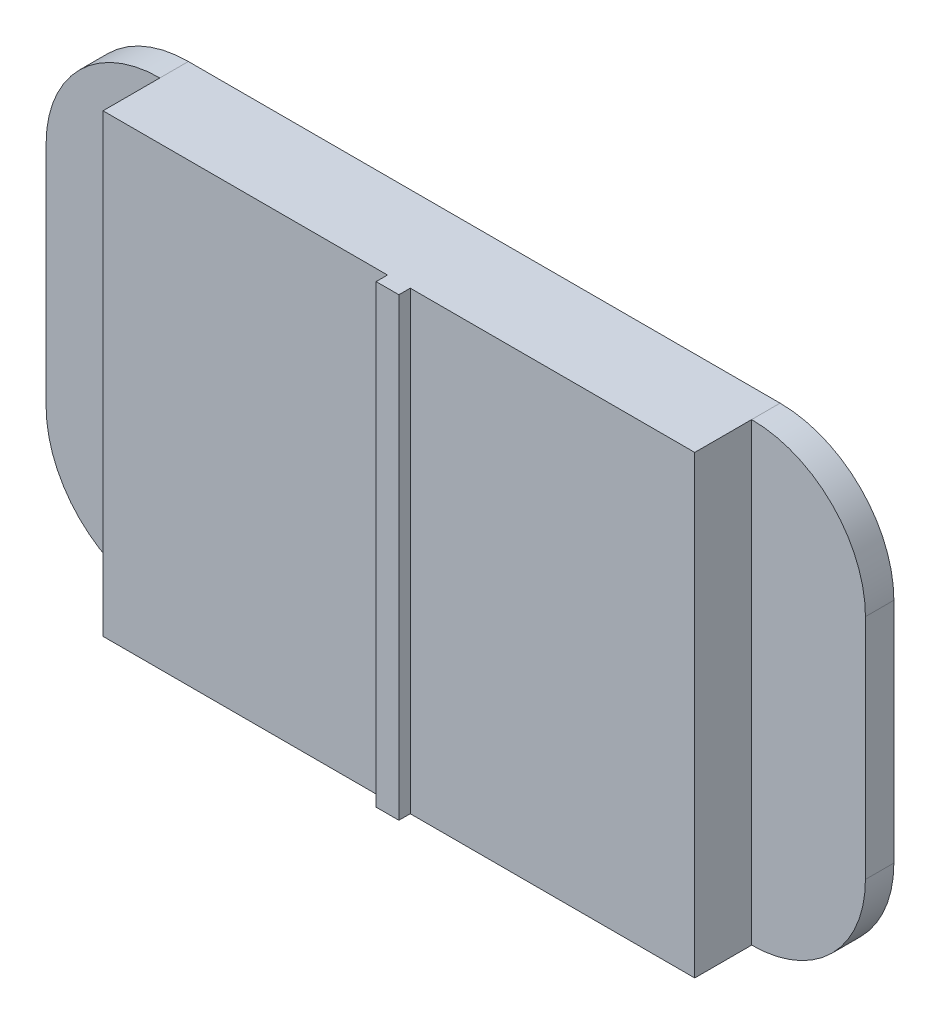
from build123d import *

# Parameters (mm, degrees)
EXTRUDE_1_DEPTH = 40
FILLET_3_R      = 10
FILLET_6_R      = 10
FILLET_7_R      = 10
FILLET_8_R      = 10


with BuildPart() as part:
    # Эскиз1 → Бобышка-Вытянуть1 (new body)
    with BuildSketch(Plane(origin=(0, 0, 0), x_dir=(1, 0, 0), z_dir=(0, 1, 0))):
        Polygon((-26, -14.521028037), (-26, -9.521028037), (-32, -9.521028037), (-36, -9.521028037), (-36, -7.021028037), (-1, -7.021028037), (1, -7.021028037), (36, -7.021028037), (36, -9.521028037), (32, -9.521028037), (26, -9.521028037), (26, -14.521028037), (1, -14.521028037), (1, -15.521028037), (-1, -15.521028037), (-1, -14.521028037), align=None)
    extrude(amount=EXTRUDE_1_DEPTH)

    # Скругление3
    fillet_3_edges = [part.edges().sort_by_distance(p)[0] for p in [
        (-36, 40, 8.271028037),
    ]]
    fillet(fillet_3_edges, radius=FILLET_3_R)

    # Скругление6
    fillet_6_edges = [part.edges().sort_by_distance(p)[0] for p in [
        (-36, 0, 8.271028037),
    ]]
    fillet(fillet_6_edges, radius=FILLET_6_R)

    # Скругление7
    fillet_7_edges = [part.edges().sort_by_distance(p)[0] for p in [
        (36, 40, 8.271028037),
    ]]
    fillet(fillet_7_edges, radius=FILLET_7_R)

    # Скругление8
    fillet_8_edges = [part.edges().sort_by_distance(p)[0] for p in [
        (36, 0, 8.271028037),
    ]]
    fillet(fillet_8_edges, radius=FILLET_8_R)


solid = part.part
